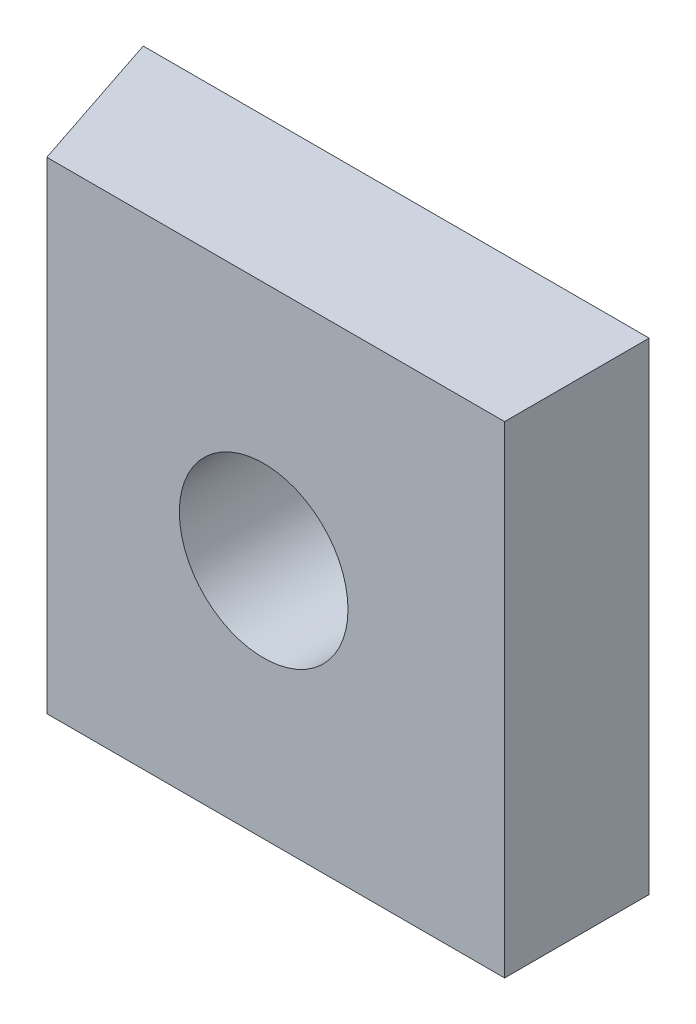
from build123d import *

# Parameters (mm, degrees)
BOSS_EXTRUDE1_DEPTH = 10
SKETCH2_R           = 1.75
CUT_EXTRUDE1_DEPTH  = 15.807092895


with BuildPart() as part:
    # Sketch1 → Boss-Extrude1 (new body)
    with BuildSketch(Plane(origin=(0, 0, 0), x_dir=(1, 0, 0), z_dir=(0, 1, 0))):
        Polygon((0, 0), (0, 3), (-10.5, 3), (-9.5, 0), align=None)
    extrude(amount=BOSS_EXTRUDE1_DEPTH)

    # Sketch2 → Cut-Extrude1 (cut, through all)
    with BuildSketch(Plane(origin=(0, 0, -3), x_dir=(-1, 0, 0), z_dir=(0, 0, -1))):
        with Locations((5, 5)):
            Circle(SKETCH2_R)
    extrude(amount=-CUT_EXTRUDE1_DEPTH, mode=Mode.SUBTRACT)


solid = part.part
